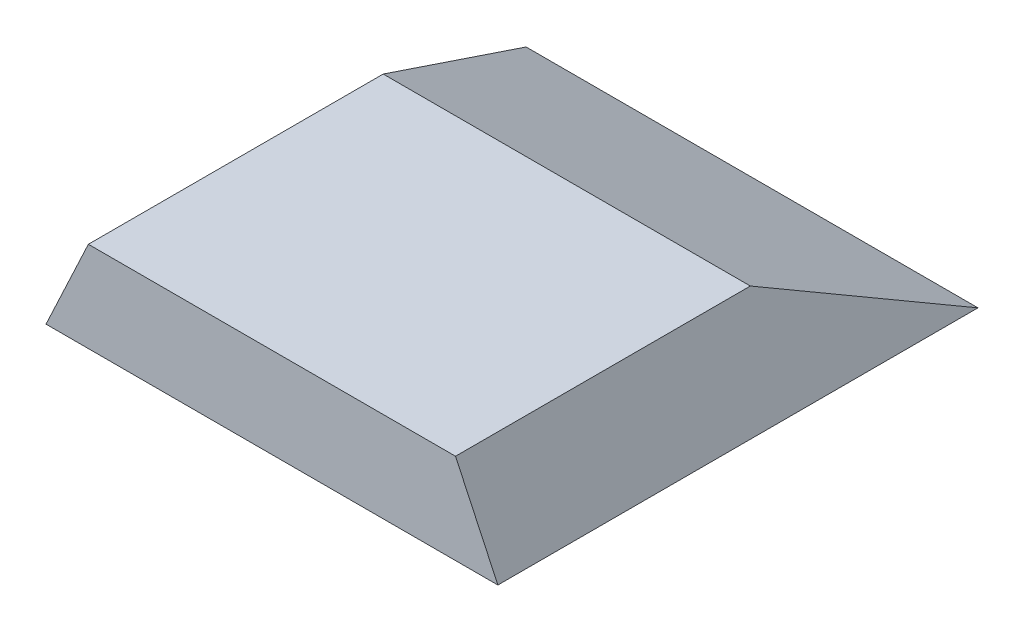
from build123d import *

# Parameters (mm, degrees)
BOSS_EXTRUDE1_DEPTH     = 17
CUT_EXTRUDE1_DEPTH      = 20.058856209
CUT_EXTRUDE1_DEPTH_BACK = 20.058856209


with BuildPart() as part:
    # Sketch1 → Boss-Extrude1 (new body)
    with BuildSketch(Plane.XY):
        Polygon((-6.5, 3.2), (-8, 0), (8, 0), (6.5, 3.2), align=None)
    extrude(amount=BOSS_EXTRUDE1_DEPTH)

    # Sketch2 → Cut-Extrude1 (cut, two sides: drawn at the far end of the back side and taken through both)
    with BuildSketch(Plane(origin=(0, 0, 0), x_dir=(0, 0, -1), z_dir=(1, 0, 0)).offset(-CUT_EXTRUDE1_DEPTH_BACK)):
        Polygon((0, 0), (-6.560972293, 3.2), (0, 3.2), align=None)
    extrude(amount=CUT_EXTRUDE1_DEPTH + CUT_EXTRUDE1_DEPTH_BACK, mode=Mode.SUBTRACT)


solid = part.part
